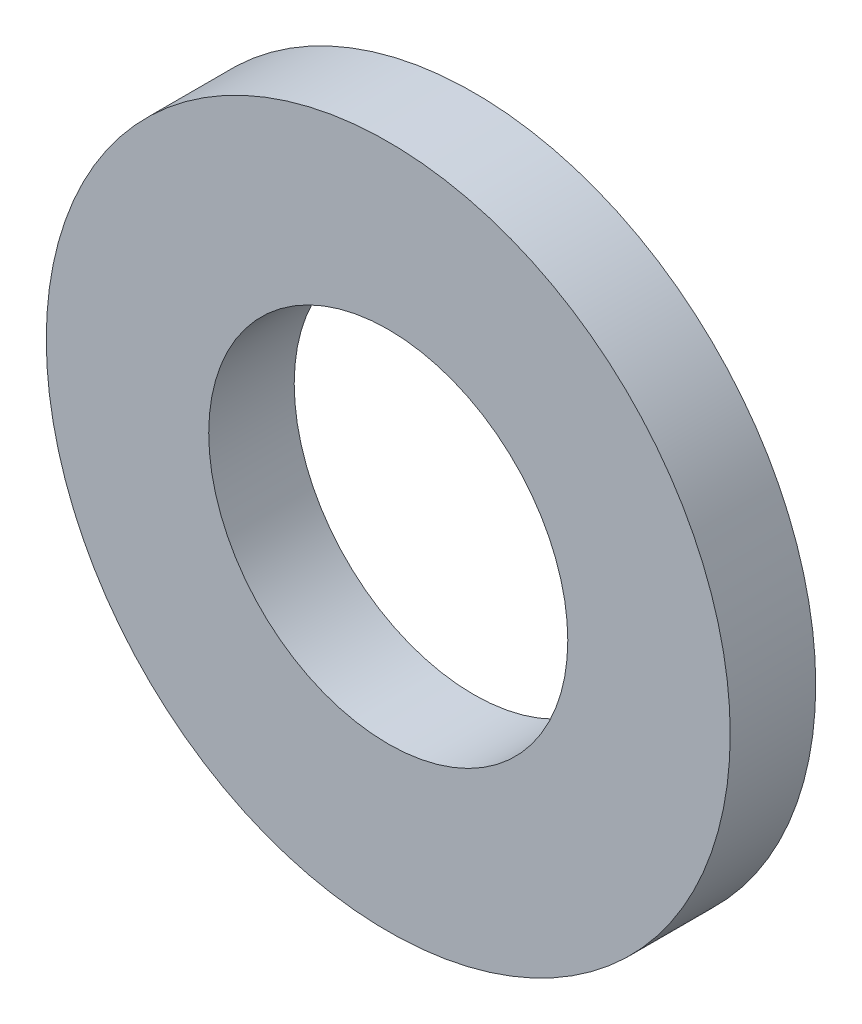
from build123d import *

# Parameters (mm, degrees)
SKETCH1_R           = 2
SKETCH1_R_2         = 1.05
RING_ENVELOPE_DEPTH = 0.5


with BuildPart() as part:
    # Sketch1 → Ring_Envelope (new body)
    with BuildSketch(Plane.XY):
        Circle(SKETCH1_R)
        Circle(SKETCH1_R_2, mode=Mode.SUBTRACT)
    extrude(amount=RING_ENVELOPE_DEPTH)


solid = part.part
